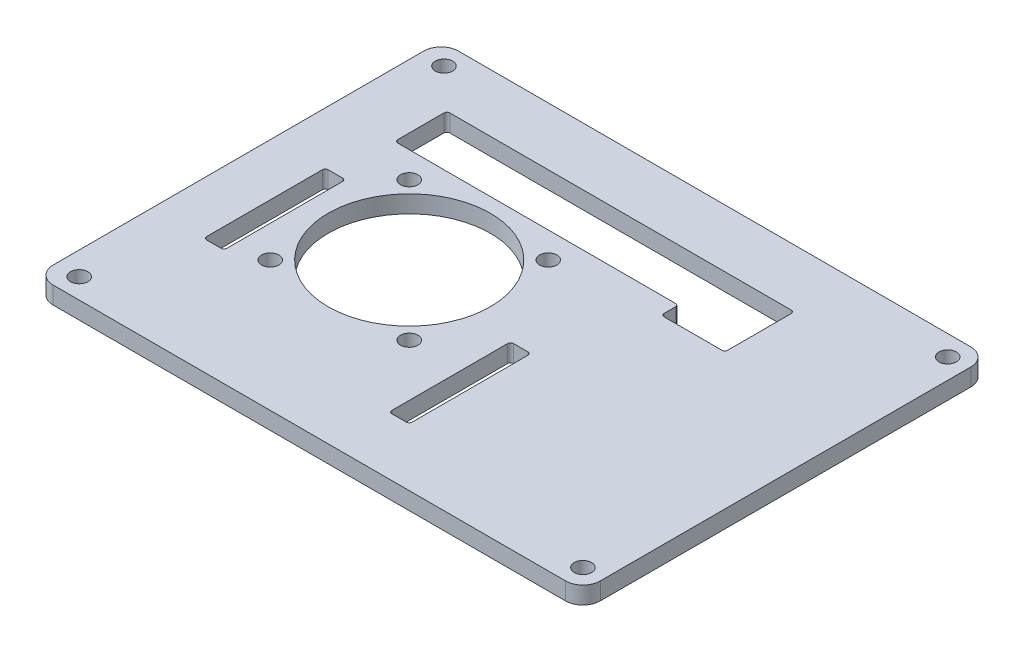
from build123d import *

# Parameters (mm, degrees)
SKETCH1_W           = 94.5
SKETCH1_H           = 70
BOSS_EXTRUDE1_DEPTH = 3
SKETCH2_R           = 14
SKETCH2_R_2         = 1.5
SKETCH2_W           = 3.5
SKETCH2_H           = 21
CUT_EXTRUDE1_DEPTH  = 59.877521177
FILLET1_R           = 0.5
SKETCH3_R           = 1.5
CUT_EXTRUDE2_DEPTH  = 59.877521177
FILLET2_R           = 3


with BuildPart() as part:
    # Sketch1 → Boss-Extrude1 (new body)
    with BuildSketch(Plane(origin=(0, 0, 0), x_dir=(1, 0, 0), z_dir=(0, 1, 0))):
        Rectangle(SKETCH1_W, SKETCH1_H)
    extrude(amount=BOSS_EXTRUDE1_DEPTH)

    # Sketch2 → Cut-Extrude1 (cut, through all)
    with BuildSketch(Plane(origin=(0, 3, 0), x_dir=(1, 0, 0), z_dir=(0, 1, 0))):
        with Locations(Location((-17.25, -0.5, 0), (0, 0, 270))):
            Circle(SKETCH2_R)
        with Locations(Location((-5.25, 11.5, 0), (0, 0, 270))):
            Circle(SKETCH2_R_2)
        with Locations(Location((-29.25, 11.5, 0), (0, 0, 270))):
            Circle(SKETCH2_R_2)
        with Locations(Location((-29.25, -12.5, 0), (0, 0, 270))):
            Circle(SKETCH2_R_2)
        with Locations(Location((-5.25, -12.5, 0), (0, 0, 270))):
            Circle(SKETCH2_R_2)
        Polygon((-36.25, 25), (23.75, 25), (23.75, 13), (12.75, 13), (12.75, 16), (-36.25, 16), align=None)
        with Locations((-36.5, -4.5)):
            Rectangle(SKETCH2_W, SKETCH2_H)
        with Locations((5.5, -14.5)):
            Rectangle(SKETCH2_W, SKETCH2_H)
    extrude(amount=-CUT_EXTRUDE1_DEPTH, mode=Mode.SUBTRACT)

    # Fillet1
    fillet1_edges = [part.edges().sort_by_distance(p)[0] for p in [
        (3.75, 1.5, 25),
        (3.75, 1.5, 4),
        (7.25, 1.5, 4),
        (7.25, 1.5, 25),
        (-38.25, 1.5, -6),
        (-34.75, 1.5, -6),
        (-34.75, 1.5, 15),
        (-38.25, 1.5, 15),
        (-36.25, 1.5, -16),
        (-36.25, 1.5, -25),
        (23.75, 1.5, -25),
        (23.75, 1.5, -13),
        (12.75, 1.5, -13),
        (12.75, 1.5, -16),
    ]]
    fillet(fillet1_edges, radius=FILLET1_R)

    # Sketch3 → Cut-Extrude2 (cut, through all)
    with BuildSketch(Plane(origin=(0, 3, 0), x_dir=(1, 0, 0), z_dir=(0, 1, 0))):
        with Locations(Location((43.75, 31.5, 0), (0, 0, 270))):
            Circle(SKETCH3_R)
        with Locations(Location((-43.25, 31.5, 0), (0, 0, 270))):
            Circle(SKETCH3_R)
        with Locations(Location((-43.25, -31.5, 0), (0, 0, 270))):
            Circle(SKETCH3_R)
        with Locations(Location((43.75, -31.5, 0), (0, 0, 270))):
            Circle(SKETCH3_R)
    extrude(amount=-CUT_EXTRUDE2_DEPTH, mode=Mode.SUBTRACT)

    # Fillet2
    fillet2_edges = [part.edges().sort_by_distance(p)[0] for p in [
        (47.25, 1.5, 35),
        (-47.25, 1.5, 35),
        (-47.25, 1.5, -35),
        (47.25, 1.5, -35),
    ]]
    fillet(fillet2_edges, radius=FILLET2_R)


solid = part.part
